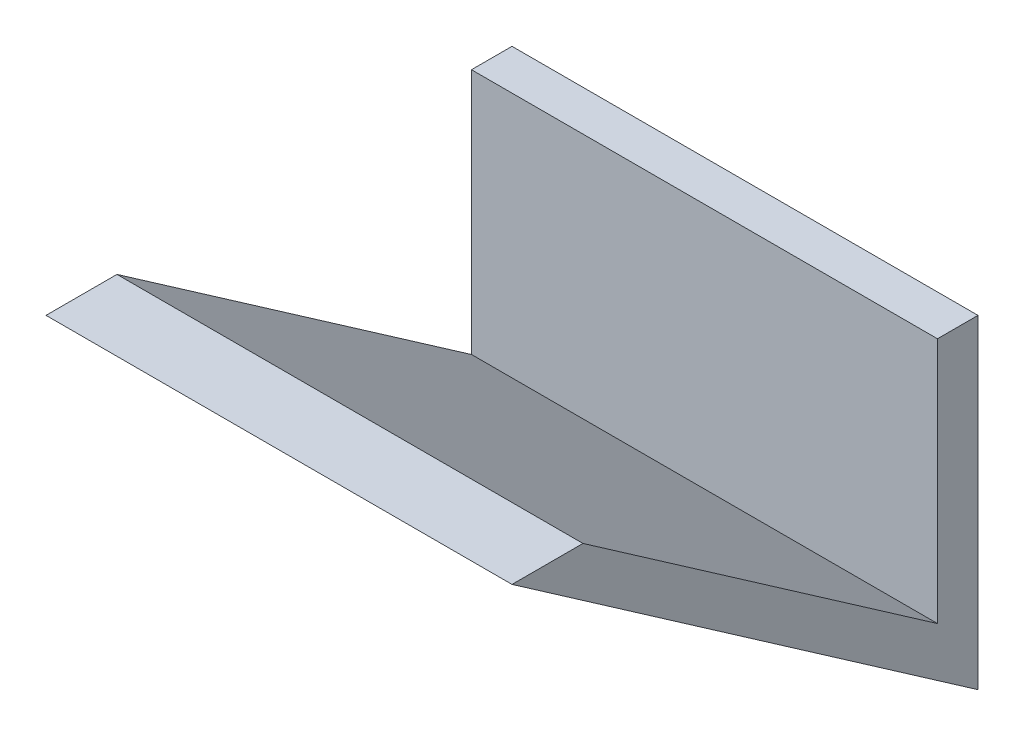
from build123d import *

# Parameters (mm, degrees)
SKETCH3_W           = 57.5
SKETCH3_H           = 40
BOSS_EXTRUDE1_DEPTH = 57.5
CUT_EXTRUDE1_DEPTH  = 86.766124704
CUT_EXTRUDE2_DEPTH  = 86.766124704


with BuildPart() as part:
    # Sketch3 → Boss-Extrude1 (new body)
    with BuildSketch(Plane.XY):
        with Locations((-2.002808989, 7.264044944)):
            Rectangle(SKETCH3_W, SKETCH3_H)
    extrude(amount=BOSS_EXTRUDE1_DEPTH)

    # Sketch7 → Cut-Extrude1 (cut, through all)
    with BuildSketch(Plane(origin=(26.747191011, 0, 0), x_dir=(0, 0, -1), z_dir=(1, 0, 0))):
        Polygon((-57.5, 27.264044944), (0, -12.735955056), (-57.5, -12.735955056), align=None)
    extrude(amount=-CUT_EXTRUDE1_DEPTH, mode=Mode.SUBTRACT)

    # Sketch8 → Cut-Extrude2 (cut, through all)
    with BuildSketch(Plane(origin=(26.747191011, 0, 0), x_dir=(0, 0, -1), z_dir=(1, 0, 0))):
        Polygon((-5, 27.264044944), (-5, -3.166856914), (-48.744421421, 27.264044944), align=None)
    extrude(amount=-CUT_EXTRUDE2_DEPTH, mode=Mode.SUBTRACT)


solid = part.part
